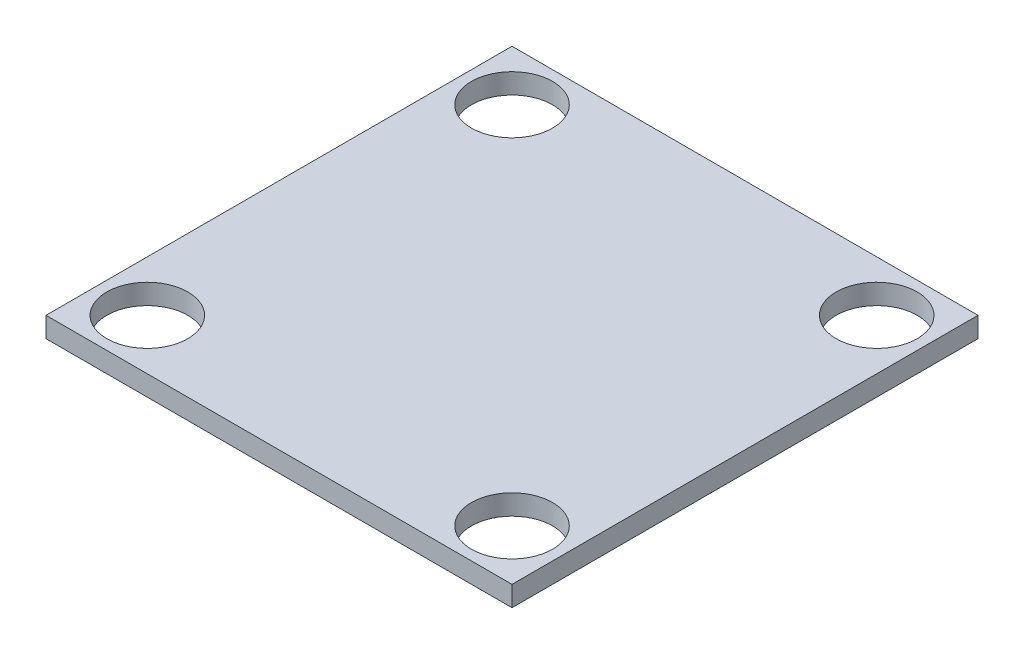
from build123d import *

# Parameters (mm, degrees)
SKETCH_1_W            = 23
SKETCH_1_H            = 23
EXTRUDE_1_DEPTH       = 0.5
HOLE_WIZARD_4_0_4_1_D = 4


with BuildPart() as part:
    # 草圖1 → 填料-伸長1 (new, symmetric)
    with BuildSketch(Plane(origin=(0, 0, 0), x_dir=(1, 0, 0), z_dir=(0, 1, 0))):
        Rectangle(SKETCH_1_W, SKETCH_1_H)
    extrude(amount=EXTRUDE_1_DEPTH, both=True)

    # Ø4.0 (4) 直徑孔1 (through all)
    with Locations(Plane(origin=(0, 0.5, 0), x_dir=(1, 0, 0), z_dir=(0, 1, 0))):
        with Locations((9, 9), (-9, -9), (-9, 9), (9, -9)):
            Hole(HOLE_WIZARD_4_0_4_1_D / 2)


solid = part.part
